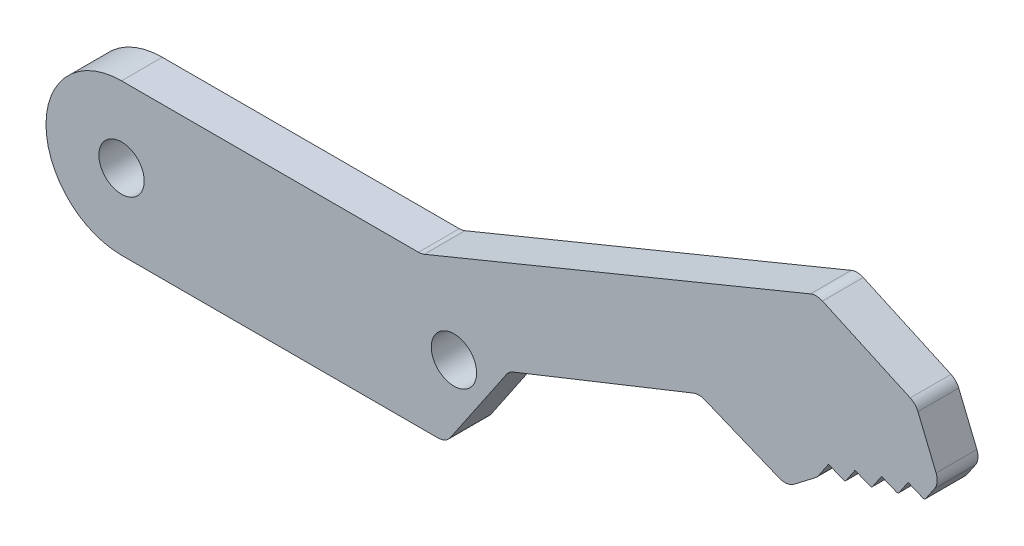
from build123d import *

# Parameters (mm, degrees)
SKETCH1_R           = 1.5
BOSS_EXTRUDE1_DEPTH = 2.7
FILLET1_R           = 0.15
FILLET2_R           = 1
FILLET3_R           = 1
FILLET4_R           = 1
SCALE1_SCALE        = 1.9


with BuildPart() as part:
    # Sketch1 → Boss-Extrude1 (new body)
    with BuildSketch(Plane.XY):
        with BuildLine():
            Line((0, 5), (19.85, 5))
            Line((19.85, 5), (45.99619398, 15.75))
            Line((45.99619398, 15.75), (52.557536486, 12.761206845))
            Line((52.557536486, 12.761206845), (53.907471601, 9.477889135))
            ThreePointArc((53.907471601, 9.477889135), (53.977314115, 8.995006796), (53.810360044, 8.536553233))
            Line((53.810360044, 8.536553233), (53.148294507, 7.559788561))
            Line((53.148294507, 7.559788561), (52.056234711, 8.006784537))
            Line((52.056234711, 8.006784537), (51.394169174, 7.030019865))
            Line((51.394169174, 7.030019865), (50.302109378, 7.477015841))
            Line((50.302109378, 7.477015841), (49.640043841, 6.500251169))
            Line((49.640043841, 6.500251169), (48.547984045, 6.947247144))
            Line((48.547984045, 6.947247144), (47.885918508, 5.970482472))
            Line((47.885918508, 5.970482472), (46.793858712, 6.417478448))
            Line((46.793858712, 6.417478448), (46.131793175, 5.440713776))
            ThreePointArc((46.131793175, 5.440713776), (46.03170075, 5.315863389), (45.912975416, 5.208576821))
            Line((45.912975416, 5.208576821), (44.507662892, 4.129714813))
            ThreePointArc((44.507662892, 4.129714813), (44.031433487, 3.93177062), (43.519903831, 3.997449854))
            Line((43.519903831, 3.997449854), (38.212047423, 6.170032768))
            Line((38.212047423, 6.170032768), (25.644379319, 1.158584034))
            Line((25.644379319, 1.158584034), (21.47, -5))
            Line((21.47, -5), (0, -5))
            ThreePointArc((0, -5), (-5, 0), (0, 5))
        make_face()
        Circle(SKETCH1_R, mode=Mode.SUBTRACT)
        with Locations((22, 0)):
            Circle(SKETCH1_R, mode=Mode.SUBTRACT)
    extrude(amount=-BOSS_EXTRUDE1_DEPTH)

    # Fillet1
    fillet1_edges = [part.edges().sort_by_distance(p)[0] for p in [
        (53.148294507, 7.559788561, -1.35),
        (51.394169174, 7.030019865, -1.35),
        (49.640043841, 6.500251169, -1.35),
        (47.885918508, 5.970482472, -1.35),
    ]]
    fillet(fillet1_edges, radius=FILLET1_R)

    # Fillet2
    fillet2_edges = [part.edges().sort_by_distance(p)[0] for p in [
        (21.47, -5, -1.35),
        (45.99619398, 15.75, -1.35),
        (52.557536486, 12.761206845, -1.35),
    ]]
    fillet(fillet2_edges, radius=FILLET2_R)

    # Fillet3
    fillet3_edges = [part.edges().sort_by_distance(p)[0] for p in [
        (38.212047423, 6.170032768, -1.35),
        (25.644379319, 1.158584034, -1.35),
    ]]
    fillet(fillet3_edges, radius=FILLET3_R)

    # Fillet4
    fillet4_edges = [part.edges().sort_by_distance(p)[0] for p in [
        (19.85, 5, -1.35),
    ]]
    fillet(fillet4_edges, radius=FILLET4_R)


with BuildPart() as part_1:
    # Scale1: scaled about (23.156973948, 3.883277681, -1.35)
    add(part.part.scale(SCALE1_SCALE).moved(Location((-20.841276553, -3.494949913, 1.215))))


solid = part_1.part
